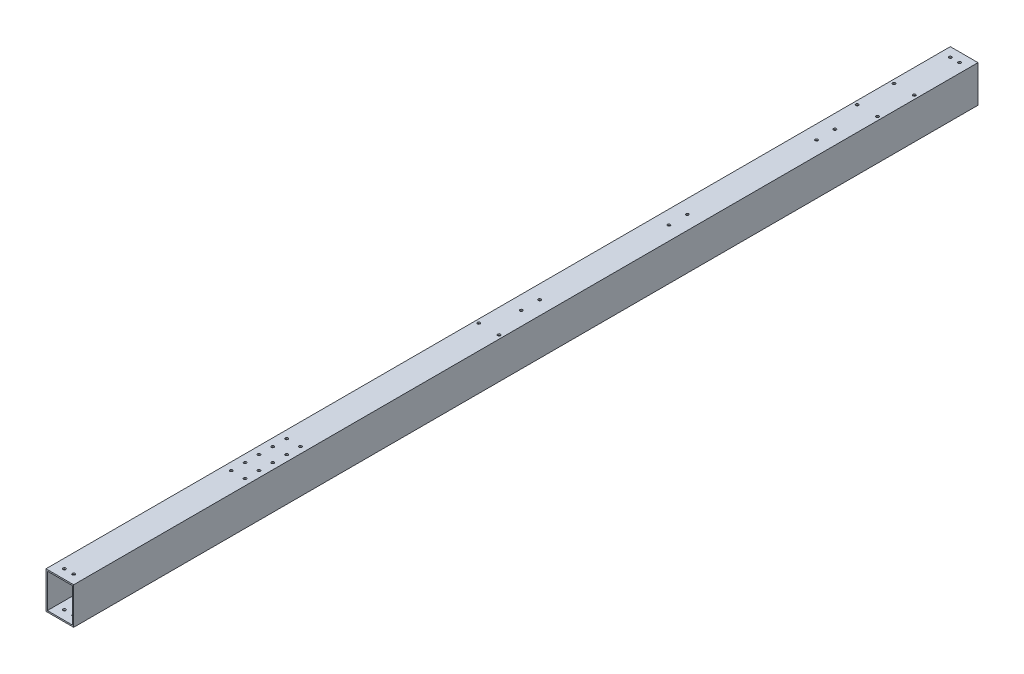
from build123d import *

# Parameters (mm, degrees)
SKETCH_1_W             = 30
SKETCH_1_H             = 40
SKETCH_1_W_2           = 27
SKETCH_1_H_2           = 37
EXTRUDE_1_DEPTH        = 980
SKETCH_2_R             = 1.5
CUT_EXTRUDE_1_DEPTH    = 1040
SKETCH_3_R             = 1.5
CUT_EXTRUDE_2_DEPTH    = 981.930680527
SKETCH_4_R             = 1.5
CUT_EXTRUDE_3_DEPTH    = 981.930680527
SKETCH_5_R             = 1.5
CUT_EXTRUDE_4_DEPTH    = 981.930680527
CUT_EXTRUDE_6_DEPTH    = 10
SKETCH_9_R             = 3.25
CUT_EXTRUDE_7_DEPTH    = 10
PATTERN_LINEAR_1_COUNT = 4
PATTERN_LINEAR_1_PITCH = 15


with BuildPart() as part:
    # 草图1 → 凸台-拉伸1 (new body)
    with BuildSketch(Plane.XY):
        Rectangle(SKETCH_1_W, SKETCH_1_H)
        Rectangle(SKETCH_1_W_2, SKETCH_1_H_2, mode=Mode.SUBTRACT)
    extrude(amount=EXTRUDE_1_DEPTH)

    # 草图2 → 切除-拉伸1 (cut)
    with BuildSketch(Plane(origin=(0, 20, 0), x_dir=(-1, 0, 0), z_dir=(0, -1, 0))):
        with Locations((11, -65)):
            Circle(SKETCH_2_R)
        with Locations((-11, -65)):
            Circle(SKETCH_2_R)
        with Locations((11, -515)):
            Circle(SKETCH_2_R)
        with Locations((-11, -515)):
            Circle(SKETCH_2_R)
        with Locations((11, -105)):
            Circle(SKETCH_2_R)
        with Locations((-11, -105)):
            Circle(SKETCH_2_R)
    extrude(amount=CUT_EXTRUDE_1_DEPTH, mode=Mode.SUBTRACT)

    # 草图3 → 切除-拉伸2 (cut, through all)
    with BuildSketch(Plane(origin=(0, 20, 0), x_dir=(-1, 0, 0), z_dir=(0, -1, 0))):
        with Locations((5, -10)):
            Circle(SKETCH_3_R)
        with Locations((-5, -10)):
            Circle(SKETCH_3_R)
        with Locations((-5, -970)):
            Circle(SKETCH_3_R)
        with Locations((5, -970)):
            Circle(SKETCH_3_R)
    extrude(amount=CUT_EXTRUDE_2_DEPTH, mode=Mode.SUBTRACT)

    # 草图4 → 切除-拉伸3 (cut, through all)
    with BuildSketch(Plane(origin=(0, 20, 0), x_dir=(-1, 0, 0), z_dir=(0, -1, 0))):
        with Locations((-8.27006126, -772.5)):
            Circle(SKETCH_4_R)
        with Locations((6.72993874, -772.5)):
            Circle(SKETCH_4_R)
        with Locations((6.72993874, -787.5)):
            Circle(SKETCH_4_R)
        with Locations((-8.27006126, -787.5)):
            Circle(SKETCH_4_R)
    cut_extrude_3 = extrude(amount=CUT_EXTRUDE_3_DEPTH, mode=Mode.SUBTRACT)

    # 草图5 → 切除-拉伸4 (cut, through all)
    with BuildSketch(Plane(origin=(0, 20, 0), x_dir=(-1, 0, 0), z_dir=(0, -1, 0))):
        with Locations((0, -140)):
            Circle(SKETCH_5_R)
        with Locations((0, -160)):
            Circle(SKETCH_5_R)
        with Locations((0, -300)):
            Circle(SKETCH_5_R)
        with Locations((0, -320)):
            Circle(SKETCH_5_R)
        with Locations((0, -480)):
            Circle(SKETCH_5_R)
        with Locations((0, -460)):
            Circle(SKETCH_5_R)
    extrude(amount=CUT_EXTRUDE_4_DEPTH, mode=Mode.SUBTRACT)

    # 草图8 → 切除-拉伸6 (cut)
    with BuildSketch(Plane.XZ.offset(20)):
        with BuildLine():
            Line((7.5, 160), (7.5, 140))
            ThreePointArc((7.5, 140), (0, 132.5), (-7.5, 140))
            Line((-7.5, 140), (-7.5, 160))
            ThreePointArc((-7.5, 160), (0, 167.5), (7.5, 160))
        make_face()
        with BuildLine():
            Line((7.5, 480), (7.5, 460))
            ThreePointArc((7.5, 460), (0, 452.5), (-7.5, 460))
            Line((-7.5, 460), (-7.5, 480))
            ThreePointArc((-7.5, 480), (0, 487.5), (7.5, 480))
        make_face()
        with BuildLine():
            Line((7.5, 320), (7.5, 300))
            ThreePointArc((7.5, 300), (0, 292.5), (-7.5, 300))
            Line((-7.5, 300), (-7.5, 320))
            ThreePointArc((-7.5, 320), (0, 327.5), (7.5, 320))
        make_face()
    extrude(amount=-CUT_EXTRUDE_6_DEPTH, mode=Mode.SUBTRACT)

    # 草图9 → 切除-拉伸7 (cut)
    with BuildSketch(Plane.XZ.offset(20)):
        with Locations((-6.72993874, 787.5)):
            Circle(SKETCH_9_R)
        with Locations((-6.72993874, 772.5)):
            Circle(SKETCH_9_R)
        with Locations((8.27006126, 772.5)):
            Circle(SKETCH_9_R)
        with Locations((8.27006126, 787.5)):
            Circle(SKETCH_9_R)
    cut_extrude_7 = extrude(amount=-CUT_EXTRUDE_7_DEPTH, mode=Mode.SUBTRACT)

    # 阵列(线性)1: 切除-拉伸3, 切除-拉伸7 ×4
    with Locations(*[(0, 0, -i * PATTERN_LINEAR_1_PITCH) for i in range(1, PATTERN_LINEAR_1_COUNT)]):
        add(cut_extrude_3, mode=Mode.SUBTRACT)
        add(cut_extrude_7, mode=Mode.SUBTRACT)


solid = part.part
